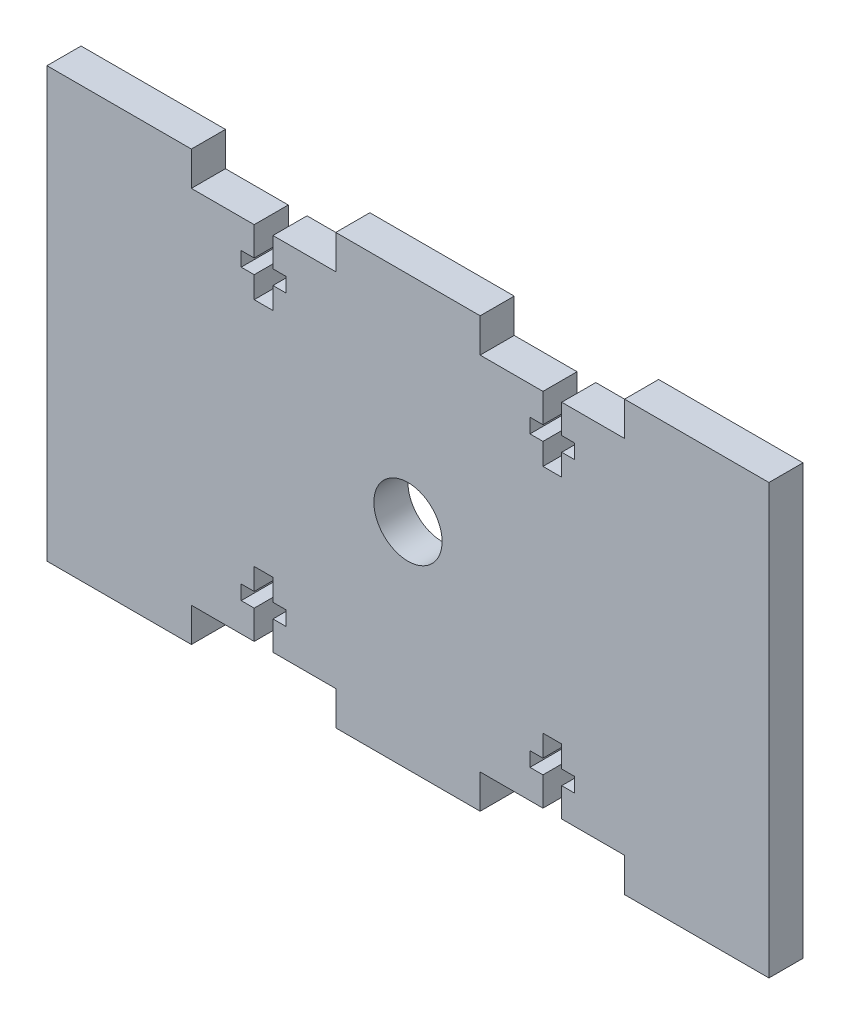
from build123d import *

# Parameters (mm, degrees)
BOSS_EXTRUDE1_DEPTH = 5.9944
CUT_EXTRUDE2_DEPTH  = 5.9944
SKETCH3_R           = 6
CUT_EXTRUDE3_DEPTH  = 5.9944


with BuildPart() as part:
    # Sketch1 → Boss-Extrude1 (new body)
    with BuildSketch(Plane.XY):
        Polygon((25.4, 5.9944), (50.8, 5.9944), (50.8, 0), (76.2, 0), (76.2, 5.9944), (101.6, 5.9944), (101.6, 0), (127, 0), (127, 75.4888), (101.6, 75.4888), (101.6, 69.4944), (76.2, 69.4944), (76.2, 75.4888), (50.8, 75.4888), (50.8, 69.4944), (25.4, 69.4944), (25.4, 75.4888), (0, 75.4888), (0, 0), (25.4, 0), align=None)
    extrude(amount=BOSS_EXTRUDE1_DEPTH)

    # Sketch2 → Cut-Extrude2 (cut)
    with BuildSketch(Plane.XY.offset(5.9944)):
        Polygon((36.449, 69.4944), (36.449, 64.4144), (34.163, 64.4144), (34.163, 61.8744), (36.449, 61.8744), (36.449, 58.0644), (39.751, 58.0644), (39.751, 61.8744), (42.037, 61.8744), (42.037, 64.4144), (39.751, 64.4144), (39.751, 69.4944), align=None)
        Polygon((36.449, 5.9944), (39.751, 5.9944), (39.751, 11.0744), (42.037, 11.0744), (42.037, 13.6144), (39.751, 13.6144), (39.751, 17.4244), (36.449, 17.4244), (36.449, 13.6144), (34.163, 13.6144), (34.163, 11.0744), (36.449, 11.0744), align=None)
        Polygon((90.551, 5.9944), (90.551, 11.0744), (92.837, 11.0744), (92.837, 13.6144), (90.551, 13.6144), (90.551, 17.4244), (87.249, 17.4244), (87.249, 13.6144), (84.963, 13.6144), (84.963, 11.0744), (87.249, 11.0744), (87.249, 5.9944), align=None)
        Polygon((90.551, 69.4944), (87.249, 69.4944), (87.249, 64.4144), (84.963, 64.4144), (84.963, 61.8744), (87.249, 61.8744), (87.249, 58.0644), (90.551, 58.0644), (90.551, 61.8744), (92.837, 61.8744), (92.837, 64.4144), (90.551, 64.4144), align=None)
    extrude(amount=-CUT_EXTRUDE2_DEPTH, mode=Mode.SUBTRACT)

    # Sketch3 → Cut-Extrude3 (cut)
    with BuildSketch(Plane.XY.offset(5.9944)):
        with Locations((63.5, 37.7444)):
            Circle(SKETCH3_R)
    extrude(amount=-CUT_EXTRUDE3_DEPTH, mode=Mode.SUBTRACT)


solid = part.part
